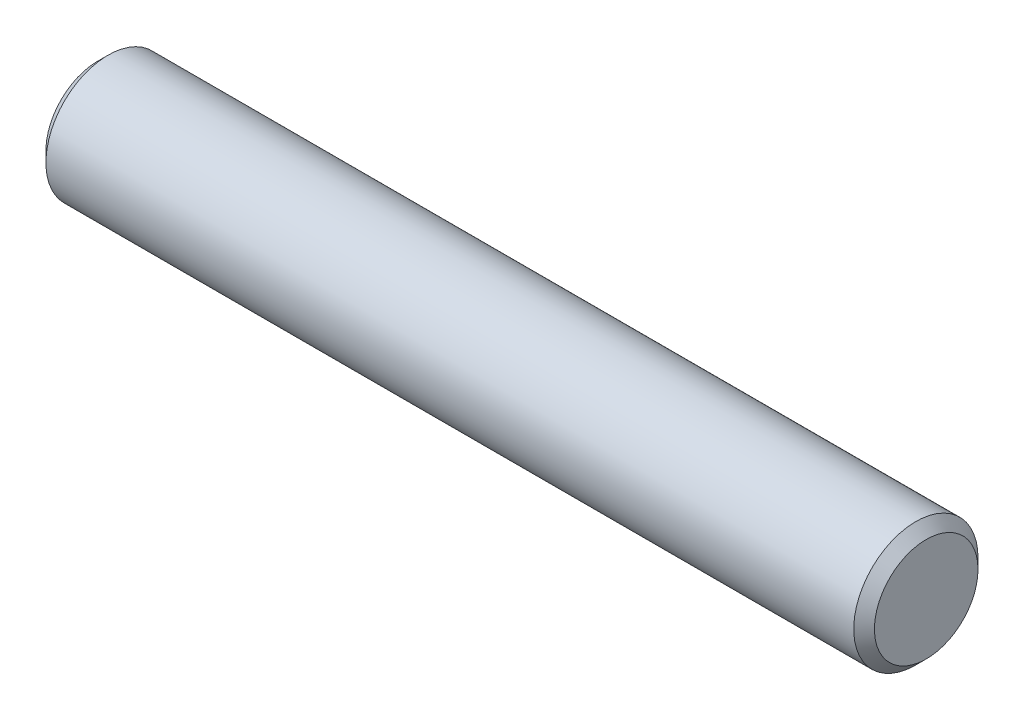
from build123d import *

# Parameters (mm, degrees)
SKETCH_1_R      = 3
EXTRUDE_1_DEPTH = 20
CHAMFER_1_SIZE  = 0.5


with BuildPart() as part:
    # Эскиз1 → Бобышка-Вытянуть1 (new, symmetric)
    with BuildSketch(Plane(origin=(0, 0, 0), x_dir=(0, 0, -1), z_dir=(1, 0, 0))):
        Circle(SKETCH_1_R)
    extrude(amount=EXTRUDE_1_DEPTH, both=True)

    # Фаска1
    chamfer_1_edges = [part.edges().sort_by_distance(p)[0] for p in [
        (-20, 0, 3),
        (20, 0, 3),
    ]]
    chamfer(chamfer_1_edges, length=CHAMFER_1_SIZE)


solid = part.part
